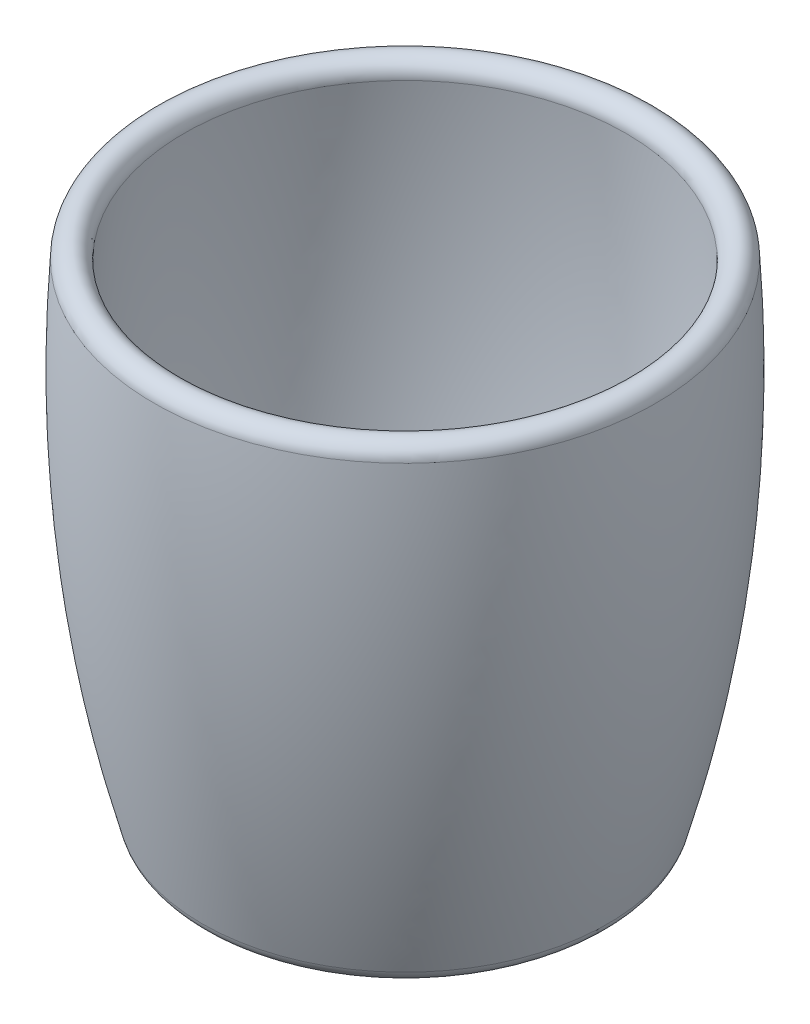
from build123d import *

# Parameters (mm, degrees)
FILLET1_R = 3


with BuildPart() as part:
    # Sketch1 → Revolve1 (revolve)
    with BuildSketch(Plane.XY, mode=Mode.PRIVATE) as revolve1_sk:
        with BuildLine():
            Line((0, 0), (33.25, 0))
            add(Edge.make_bspline(
                [(33.25, 0), (44.526415367, 39.325533825), (41.85, 81.4)],
                knots=[0, 0, 0, 1, 1, 1], degree=2))
            ThreePointArc((41.85, 81.4), (39.196335007, 83.736249581), (36.860085426, 81.082584587))
            add(Edge.make_bspline(
                [(29.450398717, 5), (39.356864782, 41.780473165), (36.860085426, 81.082584587)],
                knots=[0.046969767, 0.046969767, 0.046969767, 1, 1, 1], degree=2))
            Line((29.450398717, 5), (0, 5))
            Line((0, 5), (0, 0))
        make_face()
    revolve(revolve1_sk.sketch.rotate(Axis((0, 0, 0), (0, 1, 0)), 90), axis=Axis((0, 0, 0), (0, 1, 0)))

    # Fillet1
    fillet1_edges = [part.edges().sort_by_distance(p)[0] for p in [
        (0, 0, 33.25),
        (0, 5, 29.450398717),
    ]]
    fillet(fillet1_edges, radius=FILLET1_R)


solid = part.part
